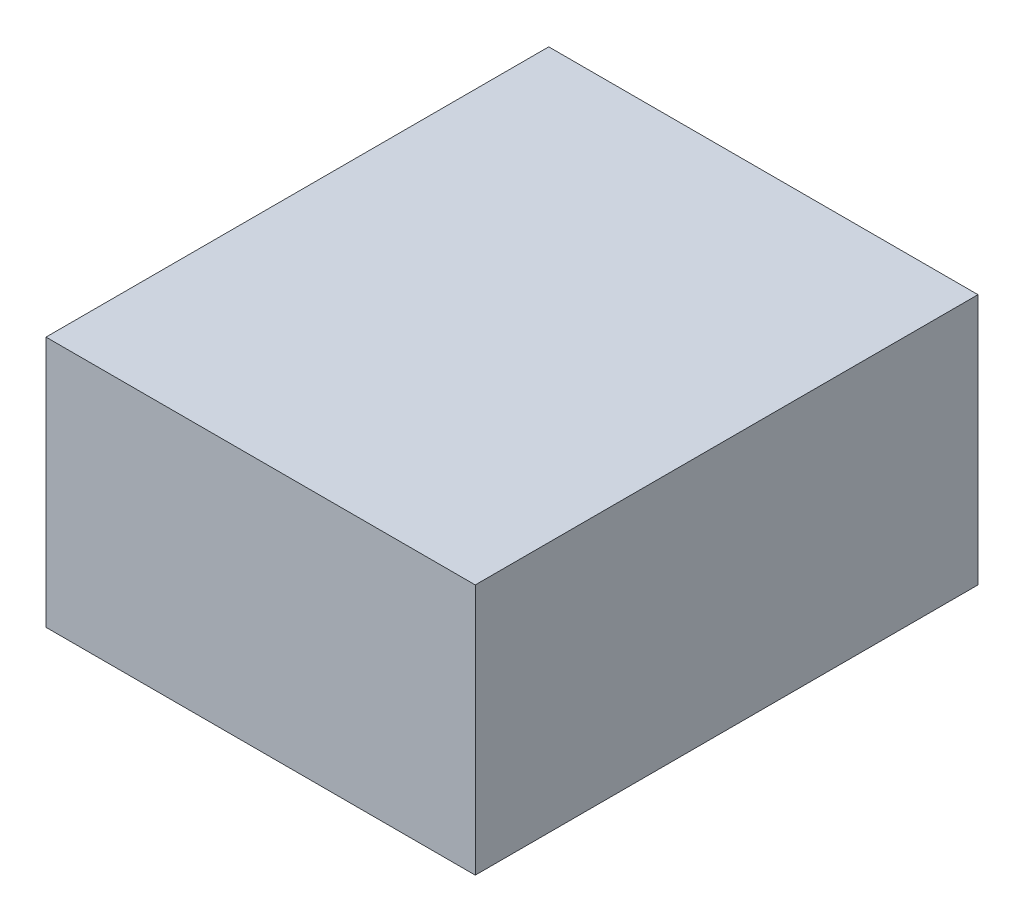
from build123d import *

# Parameters (mm, degrees)
SKETCH1_W           = 111
SKETCH1_H           = 130
BOSS_EXTRUDE1_DEPTH = 65


with BuildPart() as part:
    # Sketch1 → Boss-Extrude1 (new body)
    with BuildSketch(Plane(origin=(0, 0, 0), x_dir=(1, 0, 0), z_dir=(0, 1, 0))):
        with Locations((-17.110003859, 28.898958755)):
            Rectangle(SKETCH1_W, SKETCH1_H)
    extrude(amount=BOSS_EXTRUDE1_DEPTH)


solid = part.part
